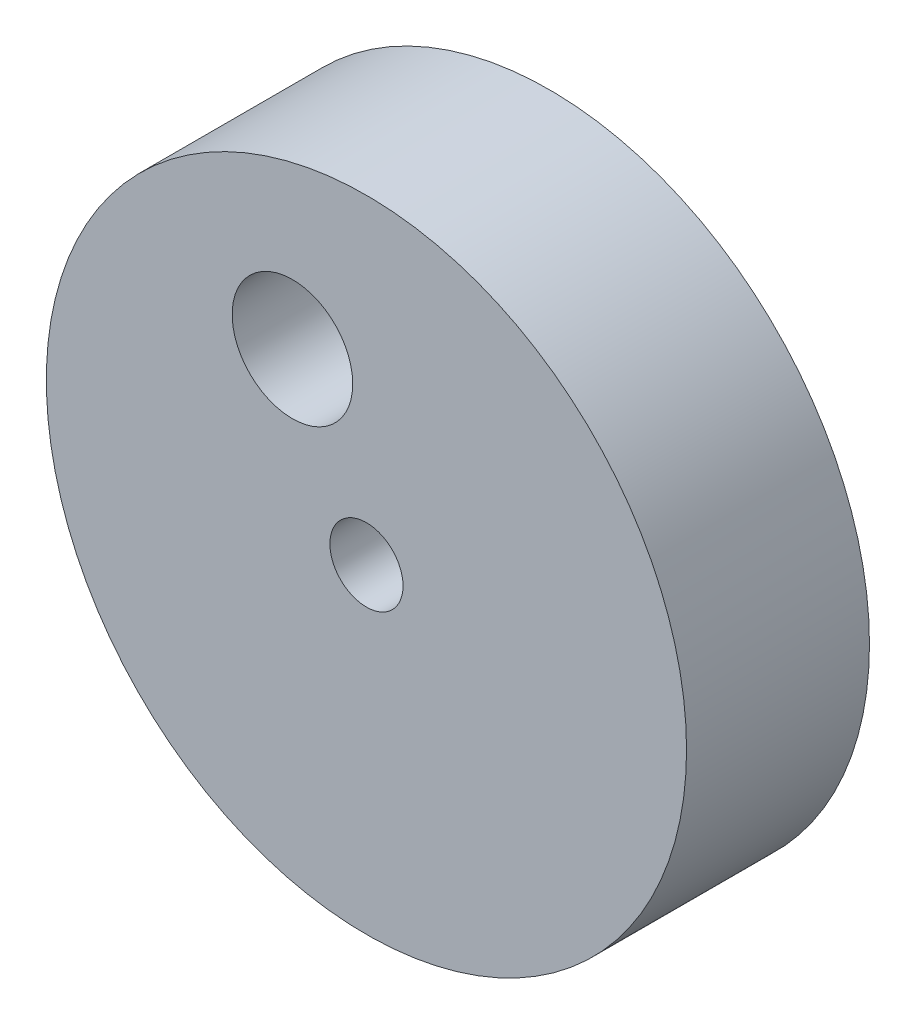
from build123d import *

# Parameters (mm, degrees)
SKETCH_1_R      = 175
SKETCH_1_R_2    = 20
SKETCH_1_R_3    = 32.95700388
EXTRUDE_1_DEPTH = 100


with BuildPart() as part:
    # ｽｹｯﾁ1 → ﾎﾞｽ - 押し出し1 (new body)
    with BuildSketch(Plane.XY):
        Circle(SKETCH_1_R)
        Circle(SKETCH_1_R_2, mode=Mode.SUBTRACT)
        with Locations((-40.464344387, 81.915624004)):
            Circle(SKETCH_1_R_3, mode=Mode.SUBTRACT)
    extrude(amount=EXTRUDE_1_DEPTH)


solid = part.part
